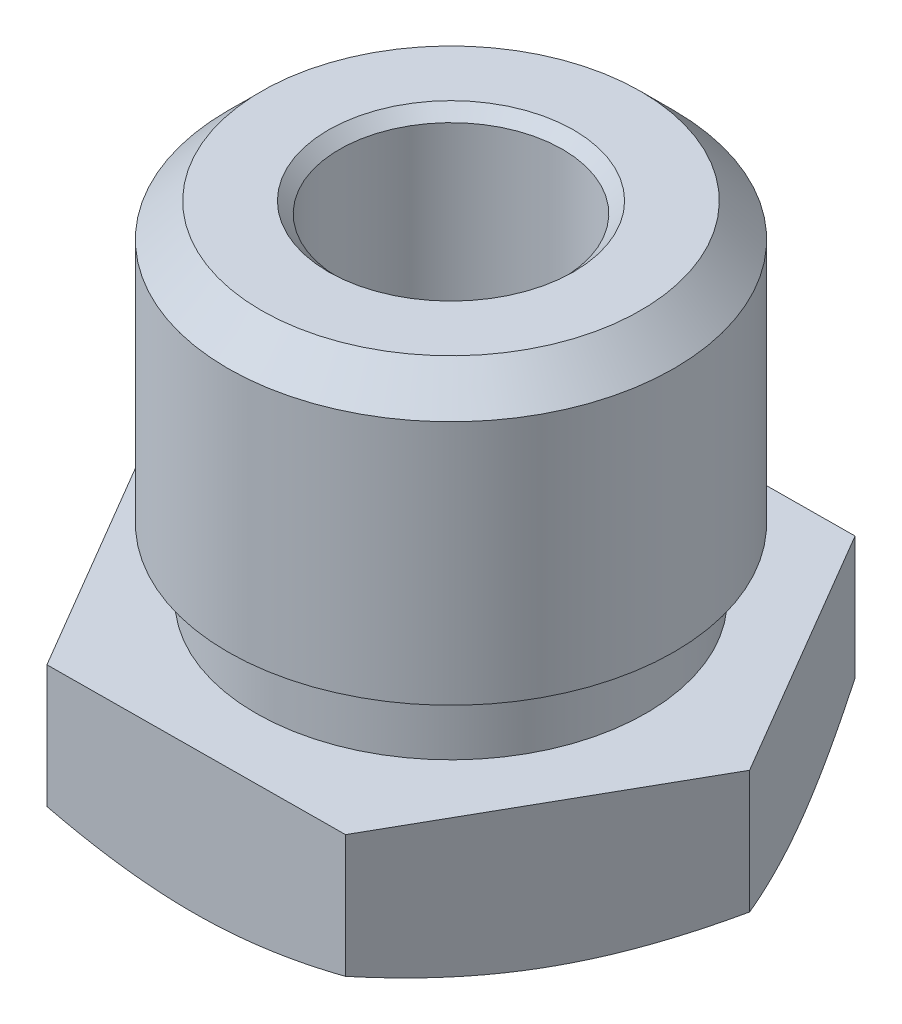
from build123d import *

# Parameters (mm, degrees)
EXTRUDE_1_DEPTH     = 6.5
SKETCH_2_R          = 8.75
EXTRUDE_2_DEPTH     = 3
SKETCH_3_R          = 10
EXTRUDE_3_DEPTH     = 12.5
CHAMFER_1_SIZE      = 1.5
SKETCH_6_R          = 5
CUT_EXTRUDE_1_DEPTH = 29.172880507
CHAMFER_2_SIZE      = 0.5


with BuildPart() as part:
    # 草图1 → 凸台-拉伸1 (new body)
    with BuildSketch(Plane(origin=(0, 0, 0), x_dir=(1, 0, 0), z_dir=(0, 1, 0))):
        Polygon((6.553289027, 11.549360859), (-6.725395388, 11.449995205), (-13.278684415, -0.099365654), (-6.553289027, -11.549360859), (6.725395388, -11.449995205), (13.278684415, 0.099365654), align=None)
    extrude(amount=EXTRUDE_1_DEPTH)

    # 草图2 → 凸台-拉伸2 (add)
    with BuildSketch(Plane(origin=(0, 6.5, 0), x_dir=(1, 0, 0), z_dir=(0, 1, 0))):
        with Locations(Location((0, 0, 0), (0, 0, 270))):
            Circle(SKETCH_2_R)
    extrude(amount=EXTRUDE_2_DEPTH)

    # 草图3 → 凸台-拉伸3 (add)
    with BuildSketch(Plane(origin=(0, 9.5, 0), x_dir=(1, 0, 0), z_dir=(0, 1, 0))):
        with Locations(Location((0, 0, 0), (0, 0, 270))):
            Circle(SKETCH_3_R)
    extrude(amount=EXTRUDE_3_DEPTH)

    # 倒角1
    chamfer_1_edges = [part.edges().sort_by_distance(p)[0] for p in [
        (0, 22, -10),
    ]]
    chamfer(chamfer_1_edges, length=CHAMFER_1_SIZE)

    # 草图5 → 切除-旋转3 (revolve, cut)
    with BuildSketch(Plane(origin=(0, 0, 0), x_dir=(0.49350563267132574, 0, -0.8697426001534446), z_dir=(0.8697426001534445, 0, 0.4935056326713257)), mode=Mode.PRIVATE) as cut_revolve_3_sk:
        Polygon((13.279056191, 1), (11.279056191, 0), (13.279056191, 0), align=None)
    revolve(cut_revolve_3_sk.sketch.rotate(Axis((0, -1000, 0), (0, 1, 0)), 180.000000003), axis=Axis((0, -1000, 0), (0, 1, 0)), mode=Mode.SUBTRACT)

    # 草图6 → 切除-拉伸1 (cut, through all)
    with BuildSketch(Plane(origin=(0, 22, 0), x_dir=(1, 0, 0), z_dir=(0, 1, 0))):
        with Locations(Location((0, 0, 0), (0, 0, 270))):
            Circle(SKETCH_6_R)
    extrude(amount=-CUT_EXTRUDE_1_DEPTH, mode=Mode.SUBTRACT)

    # 倒角2
    chamfer_2_edges = [part.edges().sort_by_distance(p)[0] for p in [
        (0, 0, -5),
        (0, 22, -5),
    ]]
    chamfer(chamfer_2_edges, length=CHAMFER_2_SIZE)


solid = part.part
